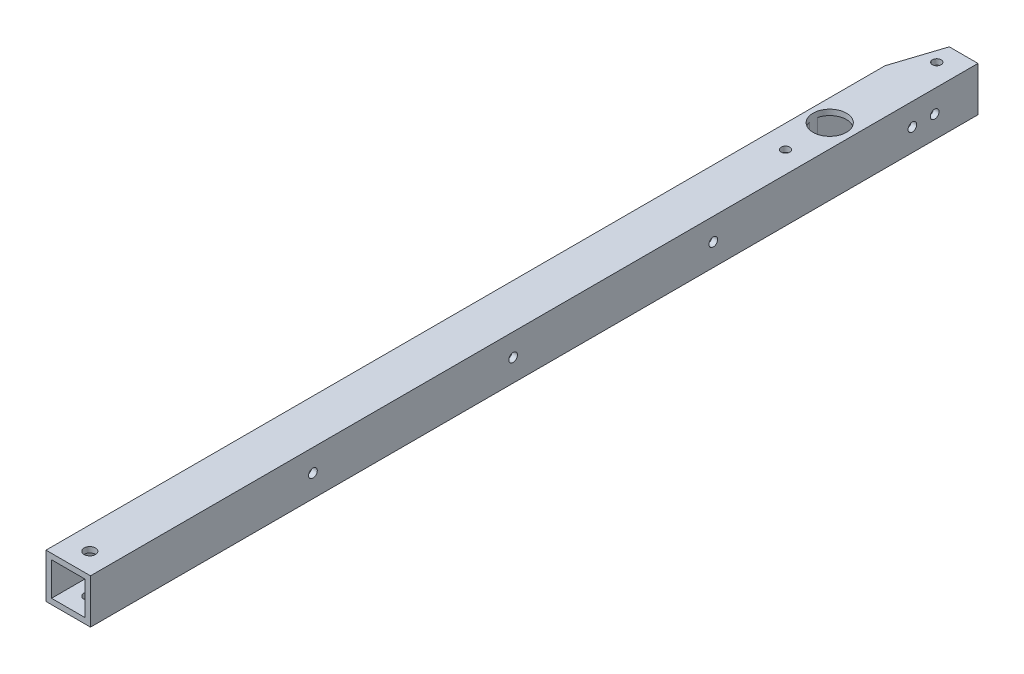
from build123d import *

# Parameters (mm, degrees)
BOSS_EXTRUDE1_DEPTH        = 260.35
BOSS_EXTRUDE1_DEPTH_BACK   = 260.35
SKETCH3_W                  = 25.4
SKETCH3_H                  = 25.4
SKETCH3_W_2                = 19.05
SKETCH3_H_2                = 19.05
CUT_EXTRUDE1_DEPTH         = 25.4
SKETCH5_R                  = 9.525
CUT_EXTRUDE2_DEPTH         = 262.894200967
F_10_CLEARANCE_HOLE2_D     = 4.9784
F_1_4_CLEARANCE_HOLE2_D    = 6.5278
F_10_CLEARANCE_HOLE3_D     = 4.9784
F_10_CLEARANCE_HOLE3_DEPTH = 5.08
F_10_CLEARANCE_HOLE3_TIP   = 1.495662253
F_10_CLEARANCE_HOLE4_D     = 4.9784


with BuildPart() as part:
    # Sketch3 → Boss-Extrude1 (new, two sides: drawn at the far end of the back side and taken through both)
    with BuildSketch(Plane.XY.offset(-BOSS_EXTRUDE1_DEPTH_BACK)):
        Rectangle(SKETCH3_W, SKETCH3_H)
        Rectangle(SKETCH3_W_2, SKETCH3_H_2, mode=Mode.SUBTRACT)
    extrude(amount=BOSS_EXTRUDE1_DEPTH + BOSS_EXTRUDE1_DEPTH_BACK)

    # Sketch4 → Cut-Extrude1 (cut)
    with BuildSketch(Plane(origin=(0, 12.7, 0), x_dir=(1, 0, 0), z_dir=(0, 1, 0))):
        Polygon((-12.7, 218.66352), (-12.7, 260.35), (12.7, 260.35), (12.7, 246.38), (-3.69316, 246.38), align=None)
    extrude(amount=-CUT_EXTRUDE1_DEPTH, mode=Mode.SUBTRACT)

    # Sketch5 → Cut-Extrude2 (cut, through all)
    with BuildSketch(Plane.XZ.offset(12.7)):
        with Locations((-0.277971341, -174.703317269)):
            Circle(SKETCH5_R)
    extrude(amount=-CUT_EXTRUDE2_DEPTH, mode=Mode.SUBTRACT)

    # #10 Clearance Hole2 (through all)
    with Locations(Plane(origin=(0, 12.7, 0), x_dir=(1, 0, 0), z_dir=(0, 1, 0))):
        with Locations((0.379684713, 148.786549658), (0.38309512, 235.173069731)):
            Hole(F_10_CLEARANCE_HOLE2_D / 2)

    # 1/4 Clearance Hole2 (through all)
    with Locations(Plane(origin=(0, 12.7, 0), x_dir=(1, 0, 0), z_dir=(0, 1, 0))):
        with Locations((0.364005636, -248.381514442)):
            Hole(F_1_4_CLEARANCE_HOLE2_D / 2)

    # #10 Clearance Hole3
    with Locations(Plane(origin=(12.7, 0, 0), x_dir=(0, 0, -1), z_dir=(1, 0, 0))):
        with Locations((221.615, 0), (208.915, 0)):
            Hole(F_10_CLEARANCE_HOLE3_D / 2, depth=F_10_CLEARANCE_HOLE3_DEPTH)
            with Locations((0, 0, -(F_10_CLEARANCE_HOLE3_DEPTH + F_10_CLEARANCE_HOLE3_TIP / 2))):  # 118° drill point
                Cone(0, F_10_CLEARANCE_HOLE3_D / 2, F_10_CLEARANCE_HOLE3_TIP, mode=Mode.SUBTRACT)

    # #10 Clearance Hole4 (through all)
    with Locations(Plane(origin=(12.7, 0, 0), x_dir=(0, 0, -1), z_dir=(1, 0, 0))):
        with Locations((-133.35, 0), (-19.05, 0), (95.25, 0)):
            Hole(F_10_CLEARANCE_HOLE4_D / 2)


solid = part.part
